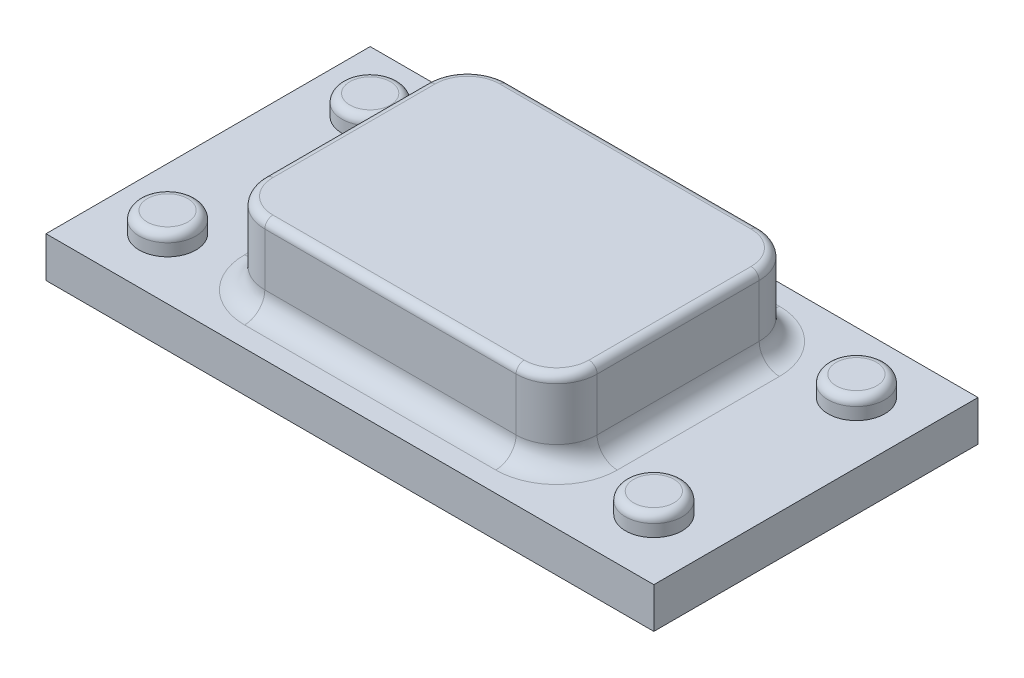
from build123d import *

# Parameters (mm, degrees)
SKETCH1_W           = 150
SKETCH1_H           = 80
BOSS_EXTRUDE1_DEPTH = 10
SKETCH2_R           = 7
BOSS_EXTRUDE2_DEPTH = 5
FILLET1_R           = 2
BOSS_EXTRUDE3_DEPTH = 20
FILLET2_R           = 2
FILLET3_R           = 5


with BuildPart() as part:
    # Sketch1 → Boss-Extrude1 (new body)
    with BuildSketch(Plane(origin=(0, 0, 0), x_dir=(1, 0, 0), z_dir=(0, 1, 0))):
        Rectangle(SKETCH1_W, SKETCH1_H)
    extrude(amount=BOSS_EXTRUDE1_DEPTH)

    # Sketch2 → Boss-Extrude2 (add)
    with BuildSketch(Plane(origin=(0, 10, 0), x_dir=(1, 0, 0), z_dir=(0, 1, 0))):
        with Locations(Location((-60, 25, 0), (0, 0, 270))):
            Circle(SKETCH2_R)
        with Locations(Location((-60, -25, 0), (0, 0, 270))):
            Circle(SKETCH2_R)
        with Locations(Location((60, -25, 0), (0, 0, 90))):
            Circle(SKETCH2_R)
        with Locations(Location((60, 25, 0), (0, 0, 90))):
            Circle(SKETCH2_R)
    extrude(amount=BOSS_EXTRUDE2_DEPTH)

    # Fillet1
    fillet1_edges = [part.edges().sort_by_distance(p)[0] for p in [
        (-60, 15, -32),
        (-60, 15, 18),
        (60, 15, 32),
        (60, 15, -18),
    ]]
    fillet(fillet1_edges, radius=FILLET1_R)

    # Sketch3 → Boss-Extrude3 (add)
    with BuildSketch(Plane(origin=(0, 10, 0), x_dir=(1, 0, 0), z_dir=(0, 1, 0))):
        with BuildLine():
            Line((-31, 30), (31, 30))
            ThreePointArc((31, 30), (38.071067812, 27.071067812), (41, 20))
            Line((41, 20), (41, -20))
            ThreePointArc((41, -20), (38.071067812, -27.071067812), (31, -30))
            Line((31, -30), (-31, -30))
            ThreePointArc((-31, -30), (-38.071067812, -27.071067812), (-41, -20))
            Line((-41, -20), (-41, 20))
            ThreePointArc((-41, 20), (-38.071067812, 27.071067812), (-31, 30))
        make_face()
    extrude(amount=BOSS_EXTRUDE3_DEPTH)

    # Fillet2
    fillet2_edges = [part.edges().sort_by_distance(p)[0] for p in [
        (-38.071067812, 30, 27.071067812),
        (0, 30, 30),
        (38.071067812, 30, 27.071067812),
        (41, 30, 0),
        (38.071067812, 30, -27.071067812),
        (0, 30, -30),
        (-38.071067812, 30, -27.071067812),
        (-41, 30, 0),
    ]]
    fillet(fillet2_edges, radius=FILLET2_R)

    # Fillet3
    fillet3_edges = [part.edges().sort_by_distance(p)[0] for p in [
        (-38.071067812, 10, 27.071067812),
        (0, 10, 30),
        (38.071067812, 10, 27.071067812),
        (41, 10, 0),
        (38.071067812, 10, -27.071067812),
        (0, 10, -30),
        (-38.071067812, 10, -27.071067812),
        (-41, 10, 0),
    ]]
    fillet(fillet3_edges, radius=FILLET3_R)


solid = part.part
